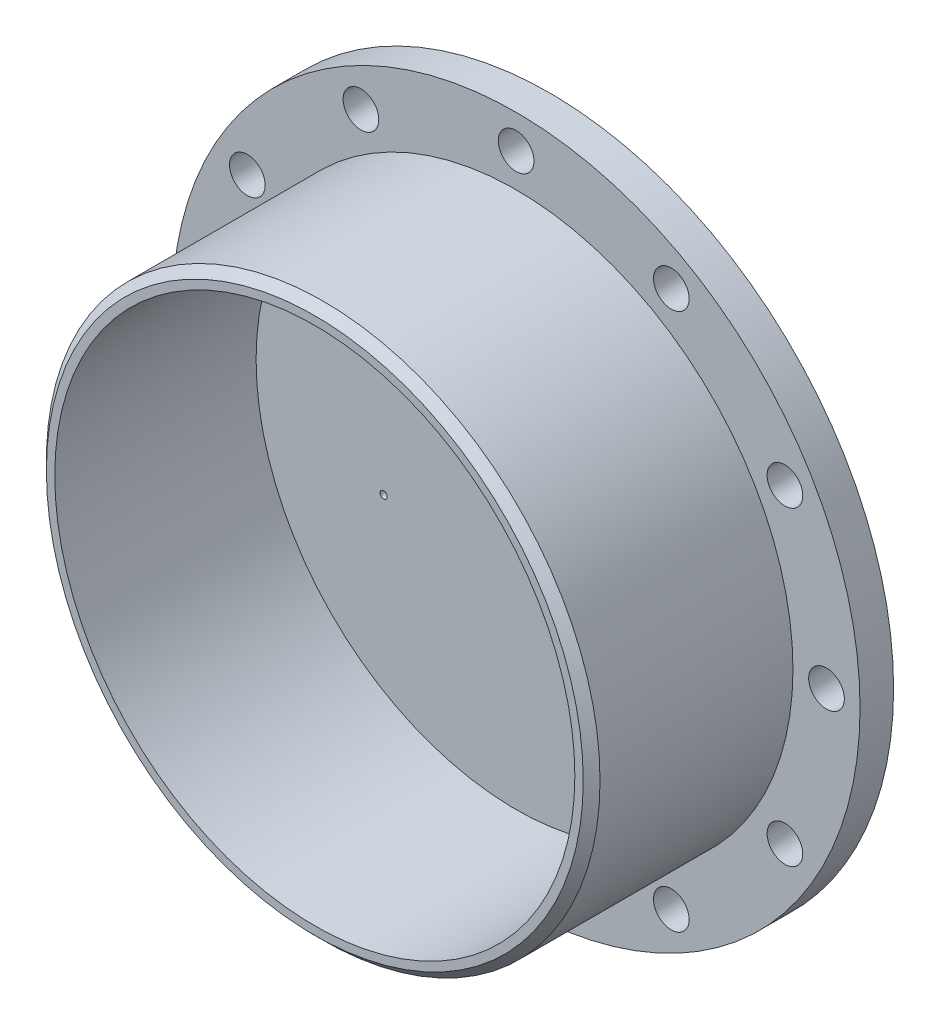
from build123d import *

# Parameters (mm, degrees)
SKETCH1_R                     = 130.175
SKETCH1_R_2                   = 104.775
BOSS_EXTRUDE1_DEPTH           = 6.35
SKETCH2_R                     = 104.775
SKETCH2_R_2                   = 98.425
BOSS_EXTRUDE2_DEPTH           = 82.55
SKETCH3_R                     = 98.425
BOSS_EXTRUDE3_DEPTH           = 6.35
CHAMFER1_SIZE                 = 3.175
F_1_2_CLEARANCE_HOLE1_D       = 13.49248
CIRPATTERN1_COUNT             = 12
MOVE_FACE1_BY                 = 6.35
TAP_DRILL_FOR_6_32_TAP1_D     = 2.7051
TAP_DRILL_FOR_6_32_TAP1_DEPTH = 6.35
TAP_DRILL_FOR_6_32_TAP1_TIP   = 0.81269403


with BuildPart() as part:
    # Sketch1 → Boss-Extrude1 (new body)
    with BuildSketch(Plane.XY):
        Circle(SKETCH1_R)
        Circle(SKETCH1_R_2, mode=Mode.SUBTRACT)
    extrude(amount=BOSS_EXTRUDE1_DEPTH)

    # Sketch2 → Boss-Extrude2 (add)
    with BuildSketch(Plane.XY):
        Circle(SKETCH2_R)
        Circle(SKETCH2_R_2, mode=Mode.SUBTRACT)
    extrude(amount=BOSS_EXTRUDE2_DEPTH)

    # Sketch3 → Boss-Extrude3 (add)
    with BuildSketch(Plane(origin=(0, 0, 0), x_dir=(-1, 0, 0), z_dir=(0, 0, -1))):
        Circle(SKETCH3_R)
    extrude(amount=-BOSS_EXTRUDE3_DEPTH)

    # Chamfer1
    chamfer1_edges = [part.edges().sort_by_distance(p)[0] for p in [
        (-104.775, 0, 82.55),
    ]]
    chamfer(chamfer1_edges, length=CHAMFER1_SIZE)

    # 1/2 Clearance Hole1 (through all)
    with Locations(Plane.XY.offset(6.35)):
        with Locations((0, 117.475)):
            f_1_2_clearance_hole1 = Hole(F_1_2_CLEARANCE_HOLE1_D / 2)

    # CirPattern1: 1/2 Clearance Hole1 ×12 about axis
    cirpattern1_axis = Axis((0, 0, 0), (0, 0, 1))
    for i in range(1, CIRPATTERN1_COUNT):
        add(f_1_2_clearance_hole1.rotate(cirpattern1_axis, i * 360 / CIRPATTERN1_COUNT), mode=Mode.SUBTRACT)

    # Move Face1: a face moved outward by 6.35
    extrude(part.faces().sort_by_distance((0, 0, 0))[0], amount=MOVE_FACE1_BY, dir=(0, 0, -1))

    # Tap Drill for #6-32 Tap1
    with Locations(Plane(origin=(-50.165, 20.32, 6.35), x_dir=(1, 0, 0), z_dir=(0, 0, 1))):
        with Locations((0, 0), (0, -40.64), (100.33, -52.07), (100.33, 11.43)):
            Hole(TAP_DRILL_FOR_6_32_TAP1_D / 2, depth=TAP_DRILL_FOR_6_32_TAP1_DEPTH)
            with Locations((0, 0, -(TAP_DRILL_FOR_6_32_TAP1_DEPTH + TAP_DRILL_FOR_6_32_TAP1_TIP / 2))):  # 118° drill point
                Cone(0, TAP_DRILL_FOR_6_32_TAP1_D / 2, TAP_DRILL_FOR_6_32_TAP1_TIP, mode=Mode.SUBTRACT)


solid = part.part
